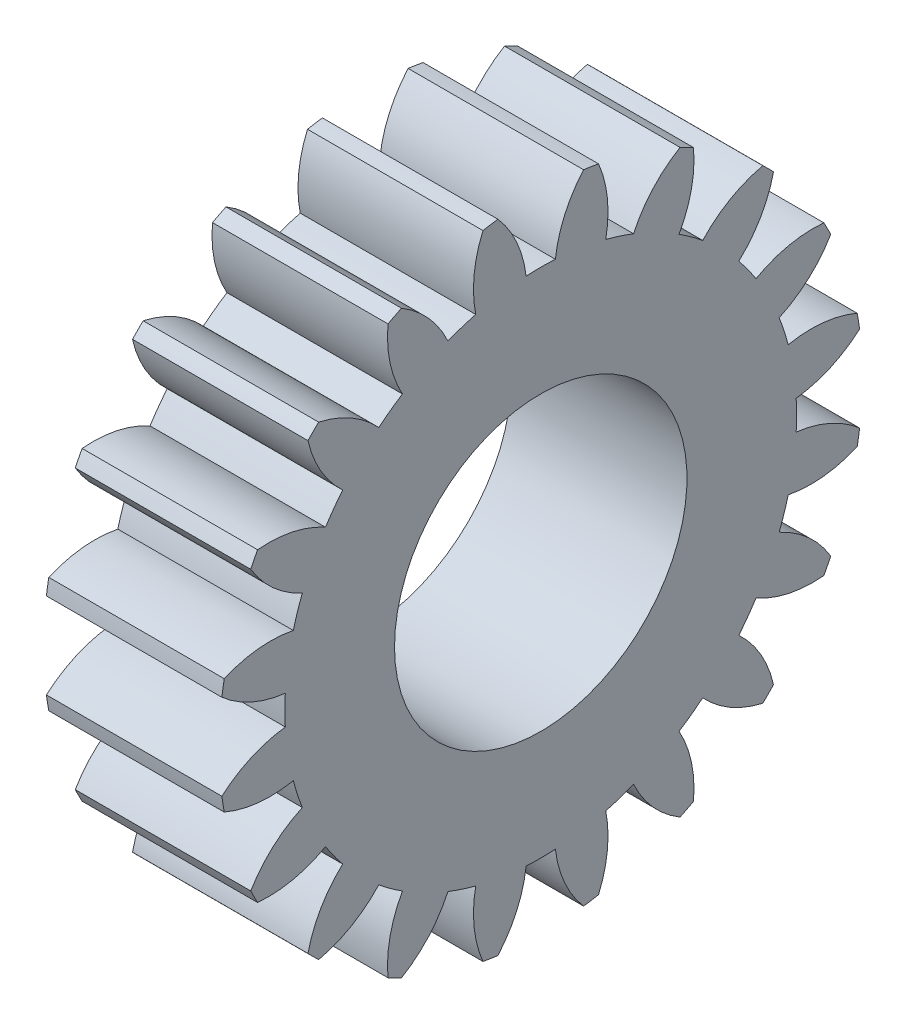
from build123d import *

# Parameters (mm, degrees)
BASPROSKE_W     = 3
BASPROSKE_H     = 5.5
TOOTHCUT_DEPTH  = 9.336666
TEETHCUTS_COUNT = 20
TEETHCUTS_ANGLE = 342
BORSKE_R        = 2.5
BORE_DEPTH      = 50.0000508


with BuildPart() as part:
    # BasProSke → Base-Revolve (revolve)
    with BuildSketch(Plane(origin=(0, 0, 0), x_dir=(1, 0, 0), z_dir=(0, 1, 0)), mode=Mode.PRIVATE) as base_revolve_sk:
        with Locations((1.5, 2.75)):
            Rectangle(BASPROSKE_W, BASPROSKE_H)
    revolve(base_revolve_sk.sketch.rotate(Axis((-10, 0, 0), (1, 0, 0)), 180), axis=Axis((-10, 0, 0), (1, 0, 0)))

    # TooCutSke → ToothCut (cut, through all)
    with BuildSketch(Plane(origin=(0, 0, 0), x_dir=(0, 0, -1), z_dir=(1, 0, 0))):
        with BuildLine():
            ThreePointArc((0.249903181, 4.366855207), (0, 4.374), (-0.249903181, 4.366855207))
            ThreePointArc((-0.249903181, 4.366855207), (-0.415207844, 4.95951031), (-0.752843848, 5.473871692))
            ThreePointArc((-0.752843848, 5.473871692), (0, 5.5254), (0.752843848, 5.473871692))
            ThreePointArc((0.752843848, 5.473871692), (0.415207844, 4.95951031), (0.249903181, 4.366855207))
        make_face()
    toothcut = extrude(amount=TOOTHCUT_DEPTH, mode=Mode.SUBTRACT)

    # TeethCuts: ToothCut ×20 about axis
    teethcuts_axis = Axis((-10, 0, 0), (1, 0, 0))
    for i in range(1, TEETHCUTS_COUNT):
        add(toothcut.rotate(teethcuts_axis, i * TEETHCUTS_ANGLE / (TEETHCUTS_COUNT - 1)), mode=Mode.SUBTRACT)

    # BorSke → Bore (cut, symmetric)
    with BuildSketch(Plane(origin=(0, 0, 0), x_dir=(0, 0, -1), z_dir=(1, 0, 0))):
        with Locations(Location((0, 0, 0), (0, 0, 180))):
            Circle(BORSKE_R)
    extrude(amount=BORE_DEPTH, both=True, mode=Mode.SUBTRACT)


solid = part.part
